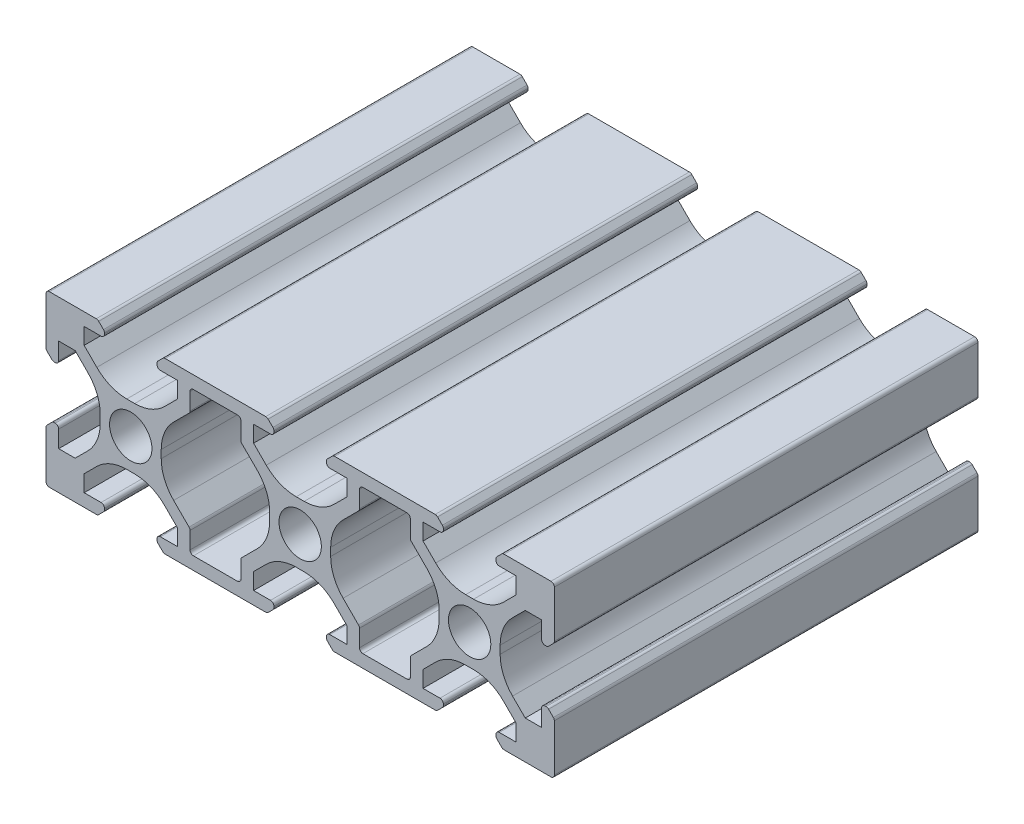
from build123d import *

# Parameters (mm, degrees)
RESSALTO_EXTRUS_O1_DEPTH    = 50
PADR_OCIRCULAR1_COUNT       = 4
PADR_O_LINEAR1_COUNT        = 3
PADR_O_LINEAR1_PITCH        = 20
PADR_O_LINEAR1_COPY_1_DEPTH = 50
PADR_O_LINEAR1_COPY_2_DEPTH = 50
PADR_O_LINEAR1_COPY_3_DEPTH = 50
PADR_O_LINEAR1_COPY_4_DEPTH = 50
PADR_O_LINEAR1_COPY_5_DEPTH = 50
PADR_O_LINEAR1_COPY_6_DEPTH = 50
CORTE_EXTRUS_O1_DEPTH       = 72.414284285
PADR_O_LINEAR2_COUNT        = 2
PADR_O_LINEAR2_PITCH        = 20
FILETE1_R                   = 0.4
FILETE2_R                   = 0.4


with BuildPart() as part:
    # Esboço1 → Ressalto-extrusão1 (new body)
    with BuildSketch(Plane.XY):
        with BuildLine():
            ThreePointArc((-9.317157288, 3.217157288), (-9.187387948, 3.130448187), (-9.034314575, 3.1))
            Line((-9.034314575, 3.1), (-8.9, 3.1))
            ThreePointArc((-8.9, 3.1), (-8.617157288, 3.217157288), (-8.5, 3.5))
            Line((-8.5, 3.5), (-8.5, 5.5))
            Line((-8.5, 5.5), (-6.560660172, 5.5))
            Line((-6.560660172, 5.5), (-5.064466094, 4.003805922))
            ThreePointArc((-5.064466094, 4.003805922), (-3.980602337, 2.381689178), (-3.6, 0.468272016))
            Line((-3.6, 0.468272016), (-3.6, 0))
            Line((-3.6, 0), (-2.5, 0))
            ThreePointArc((-2.5, 0), (-1.767766953, 1.767766953), (0, 2.5))
            Line((0, 2.5), (0, 3.6))
            Line((0, 3.6), (-0.468272016, 3.6))
            ThreePointArc((-0.468272016, 3.6), (-2.381689178, 3.980602337), (-4.003805922, 5.064466094))
            Line((-4.003805922, 5.064466094), (-5.5, 6.560660172))
            Line((-5.5, 6.560660172), (-5.5, 8.5))
            Line((-5.5, 8.5), (-3.5, 8.5))
            ThreePointArc((-3.5, 8.5), (-3.217157288, 8.617157288), (-3.1, 8.9))
            Line((-3.1, 8.9), (-3.1, 9.034314575))
            ThreePointArc((-3.1, 9.034314575), (-3.130448187, 9.187387948), (-3.217157288, 9.317157288))
            Line((-3.217157288, 9.317157288), (-3.782842712, 9.882842712))
            ThreePointArc((-3.782842712, 9.882842712), (-3.912612052, 9.969551813), (-4.065685425, 10))
            Line((-4.065685425, 10), (-10, 10))
            Line((-10, 10), (-10, 4.065685425))
            ThreePointArc((-10, 4.065685425), (-9.969551813, 3.912612052), (-9.882842712, 3.782842712))
            Line((-9.882842712, 3.782842712), (-9.317157288, 3.217157288))
        make_face()
    ressalto_extrus_o1 = extrude(amount=RESSALTO_EXTRUS_O1_DEPTH)

    # PadrãoCircular1: Ressalto-extrusão1 ×4 about axis
    padr_ocircular1_axis = Axis((0, 0, 0), (0, 0, 1))
    for i in range(1, PADR_OCIRCULAR1_COUNT):
        add(ressalto_extrus_o1.rotate(padr_ocircular1_axis, i * 360 / PADR_OCIRCULAR1_COUNT))

    # Padrão linear1: Ressalto-extrusão1 ×3
    with Locations(*[(i * PADR_O_LINEAR1_PITCH, 0, 0) for i in range(1, PADR_O_LINEAR1_COUNT)]):
        add(ressalto_extrus_o1)

    # Padrão linear1 copy 1 sketch → Padrão linear1 copy 1 (add)
    with BuildSketch(Plane(origin=(20, 0, 0), x_dir=(0, 1, 0), z_dir=(0, 0, 1))):
        with BuildLine():
            ThreePointArc((-9.317157288, 3.217157288), (-9.187387948, 3.130448187), (-9.034314575, 3.1))
            Line((-9.034314575, 3.1), (-8.9, 3.1))
            ThreePointArc((-8.9, 3.1), (-8.617157288, 3.217157288), (-8.5, 3.5))
            Line((-8.5, 3.5), (-8.5, 5.5))
            Line((-8.5, 5.5), (-6.560660172, 5.5))
            Line((-6.560660172, 5.5), (-5.064466094, 4.003805922))
            ThreePointArc((-5.064466094, 4.003805922), (-3.980602337, 2.381689178), (-3.6, 0.468272016))
            Line((-3.6, 0.468272016), (-3.6, 0))
            Line((-3.6, 0), (-2.5, 0))
            ThreePointArc((-2.5, 0), (-1.767766953, 1.767766953), (0, 2.5))
            Line((0, 2.5), (0, 3.6))
            Line((0, 3.6), (-0.468272016, 3.6))
            ThreePointArc((-0.468272016, 3.6), (-2.381689178, 3.980602337), (-4.003805922, 5.064466094))
            Line((-4.003805922, 5.064466094), (-5.5, 6.560660172))
            Line((-5.5, 6.560660172), (-5.5, 8.5))
            Line((-5.5, 8.5), (-3.5, 8.5))
            ThreePointArc((-3.5, 8.5), (-3.217157288, 8.617157288), (-3.1, 8.9))
            Line((-3.1, 8.9), (-3.1, 9.034314575))
            ThreePointArc((-3.1, 9.034314575), (-3.130448187, 9.187387948), (-3.217157288, 9.317157288))
            Line((-3.217157288, 9.317157288), (-3.782842712, 9.882842712))
            ThreePointArc((-3.782842712, 9.882842712), (-3.912612052, 9.969551813), (-4.065685425, 10))
            Line((-4.065685425, 10), (-10, 10))
            Line((-10, 10), (-10, 4.065685425))
            ThreePointArc((-10, 4.065685425), (-9.969551813, 3.912612052), (-9.882842712, 3.782842712))
            Line((-9.882842712, 3.782842712), (-9.317157288, 3.217157288))
        make_face()
    extrude(amount=PADR_O_LINEAR1_COPY_1_DEPTH)

    # Padrão linear1 copy 2 sketch → Padrão linear1 copy 2 (add)
    with BuildSketch(Plane(origin=(40, 0, 0), x_dir=(0, 1, 0), z_dir=(0, 0, 1))):
        with BuildLine():
            ThreePointArc((-9.317157288, 3.217157288), (-9.187387948, 3.130448187), (-9.034314575, 3.1))
            Line((-9.034314575, 3.1), (-8.9, 3.1))
            ThreePointArc((-8.9, 3.1), (-8.617157288, 3.217157288), (-8.5, 3.5))
            Line((-8.5, 3.5), (-8.5, 5.5))
            Line((-8.5, 5.5), (-6.560660172, 5.5))
            Line((-6.560660172, 5.5), (-5.064466094, 4.003805922))
            ThreePointArc((-5.064466094, 4.003805922), (-3.980602337, 2.381689178), (-3.6, 0.468272016))
            Line((-3.6, 0.468272016), (-3.6, 0))
            Line((-3.6, 0), (-2.5, 0))
            ThreePointArc((-2.5, 0), (-1.767766953, 1.767766953), (0, 2.5))
            Line((0, 2.5), (0, 3.6))
            Line((0, 3.6), (-0.468272016, 3.6))
            ThreePointArc((-0.468272016, 3.6), (-2.381689178, 3.980602337), (-4.003805922, 5.064466094))
            Line((-4.003805922, 5.064466094), (-5.5, 6.560660172))
            Line((-5.5, 6.560660172), (-5.5, 8.5))
            Line((-5.5, 8.5), (-3.5, 8.5))
            ThreePointArc((-3.5, 8.5), (-3.217157288, 8.617157288), (-3.1, 8.9))
            Line((-3.1, 8.9), (-3.1, 9.034314575))
            ThreePointArc((-3.1, 9.034314575), (-3.130448187, 9.187387948), (-3.217157288, 9.317157288))
            Line((-3.217157288, 9.317157288), (-3.782842712, 9.882842712))
            ThreePointArc((-3.782842712, 9.882842712), (-3.912612052, 9.969551813), (-4.065685425, 10))
            Line((-4.065685425, 10), (-10, 10))
            Line((-10, 10), (-10, 4.065685425))
            ThreePointArc((-10, 4.065685425), (-9.969551813, 3.912612052), (-9.882842712, 3.782842712))
            Line((-9.882842712, 3.782842712), (-9.317157288, 3.217157288))
        make_face()
    extrude(amount=PADR_O_LINEAR1_COPY_2_DEPTH)

    # Padrão linear1 copy 3 sketch → Padrão linear1 copy 3 (add)
    with BuildSketch(Plane(origin=(20, 0, 0), x_dir=(-1, 0, 0), z_dir=(0, 0, 1))):
        with BuildLine():
            ThreePointArc((-9.317157288, 3.217157288), (-9.187387948, 3.130448187), (-9.034314575, 3.1))
            Line((-9.034314575, 3.1), (-8.9, 3.1))
            ThreePointArc((-8.9, 3.1), (-8.617157288, 3.217157288), (-8.5, 3.5))
            Line((-8.5, 3.5), (-8.5, 5.5))
            Line((-8.5, 5.5), (-6.560660172, 5.5))
            Line((-6.560660172, 5.5), (-5.064466094, 4.003805922))
            ThreePointArc((-5.064466094, 4.003805922), (-3.980602337, 2.381689178), (-3.6, 0.468272016))
            Line((-3.6, 0.468272016), (-3.6, 0))
            Line((-3.6, 0), (-2.5, 0))
            ThreePointArc((-2.5, 0), (-1.767766953, 1.767766953), (0, 2.5))
            Line((0, 2.5), (0, 3.6))
            Line((0, 3.6), (-0.468272016, 3.6))
            ThreePointArc((-0.468272016, 3.6), (-2.381689178, 3.980602337), (-4.003805922, 5.064466094))
            Line((-4.003805922, 5.064466094), (-5.5, 6.560660172))
            Line((-5.5, 6.560660172), (-5.5, 8.5))
            Line((-5.5, 8.5), (-3.5, 8.5))
            ThreePointArc((-3.5, 8.5), (-3.217157288, 8.617157288), (-3.1, 8.9))
            Line((-3.1, 8.9), (-3.1, 9.034314575))
            ThreePointArc((-3.1, 9.034314575), (-3.130448187, 9.187387948), (-3.217157288, 9.317157288))
            Line((-3.217157288, 9.317157288), (-3.782842712, 9.882842712))
            ThreePointArc((-3.782842712, 9.882842712), (-3.912612052, 9.969551813), (-4.065685425, 10))
            Line((-4.065685425, 10), (-10, 10))
            Line((-10, 10), (-10, 4.065685425))
            ThreePointArc((-10, 4.065685425), (-9.969551813, 3.912612052), (-9.882842712, 3.782842712))
            Line((-9.882842712, 3.782842712), (-9.317157288, 3.217157288))
        make_face()
    extrude(amount=PADR_O_LINEAR1_COPY_3_DEPTH)

    # Padrão linear1 copy 4 sketch → Padrão linear1 copy 4 (add)
    with BuildSketch(Plane(origin=(40, 0, 0), x_dir=(-1, 0, 0), z_dir=(0, 0, 1))):
        with BuildLine():
            ThreePointArc((-9.317157288, 3.217157288), (-9.187387948, 3.130448187), (-9.034314575, 3.1))
            Line((-9.034314575, 3.1), (-8.9, 3.1))
            ThreePointArc((-8.9, 3.1), (-8.617157288, 3.217157288), (-8.5, 3.5))
            Line((-8.5, 3.5), (-8.5, 5.5))
            Line((-8.5, 5.5), (-6.560660172, 5.5))
            Line((-6.560660172, 5.5), (-5.064466094, 4.003805922))
            ThreePointArc((-5.064466094, 4.003805922), (-3.980602337, 2.381689178), (-3.6, 0.468272016))
            Line((-3.6, 0.468272016), (-3.6, 0))
            Line((-3.6, 0), (-2.5, 0))
            ThreePointArc((-2.5, 0), (-1.767766953, 1.767766953), (0, 2.5))
            Line((0, 2.5), (0, 3.6))
            Line((0, 3.6), (-0.468272016, 3.6))
            ThreePointArc((-0.468272016, 3.6), (-2.381689178, 3.980602337), (-4.003805922, 5.064466094))
            Line((-4.003805922, 5.064466094), (-5.5, 6.560660172))
            Line((-5.5, 6.560660172), (-5.5, 8.5))
            Line((-5.5, 8.5), (-3.5, 8.5))
            ThreePointArc((-3.5, 8.5), (-3.217157288, 8.617157288), (-3.1, 8.9))
            Line((-3.1, 8.9), (-3.1, 9.034314575))
            ThreePointArc((-3.1, 9.034314575), (-3.130448187, 9.187387948), (-3.217157288, 9.317157288))
            Line((-3.217157288, 9.317157288), (-3.782842712, 9.882842712))
            ThreePointArc((-3.782842712, 9.882842712), (-3.912612052, 9.969551813), (-4.065685425, 10))
            Line((-4.065685425, 10), (-10, 10))
            Line((-10, 10), (-10, 4.065685425))
            ThreePointArc((-10, 4.065685425), (-9.969551813, 3.912612052), (-9.882842712, 3.782842712))
            Line((-9.882842712, 3.782842712), (-9.317157288, 3.217157288))
        make_face()
    extrude(amount=PADR_O_LINEAR1_COPY_4_DEPTH)

    # Padrão linear1 copy 5 sketch → Padrão linear1 copy 5 (add)
    with BuildSketch(Plane(origin=(20, 0, 0), x_dir=(0, -1, 0), z_dir=(0, 0, 1))):
        with BuildLine():
            ThreePointArc((-9.317157288, 3.217157288), (-9.187387948, 3.130448187), (-9.034314575, 3.1))
            Line((-9.034314575, 3.1), (-8.9, 3.1))
            ThreePointArc((-8.9, 3.1), (-8.617157288, 3.217157288), (-8.5, 3.5))
            Line((-8.5, 3.5), (-8.5, 5.5))
            Line((-8.5, 5.5), (-6.560660172, 5.5))
            Line((-6.560660172, 5.5), (-5.064466094, 4.003805922))
            ThreePointArc((-5.064466094, 4.003805922), (-3.980602337, 2.381689178), (-3.6, 0.468272016))
            Line((-3.6, 0.468272016), (-3.6, 0))
            Line((-3.6, 0), (-2.5, 0))
            ThreePointArc((-2.5, 0), (-1.767766953, 1.767766953), (0, 2.5))
            Line((0, 2.5), (0, 3.6))
            Line((0, 3.6), (-0.468272016, 3.6))
            ThreePointArc((-0.468272016, 3.6), (-2.381689178, 3.980602337), (-4.003805922, 5.064466094))
            Line((-4.003805922, 5.064466094), (-5.5, 6.560660172))
            Line((-5.5, 6.560660172), (-5.5, 8.5))
            Line((-5.5, 8.5), (-3.5, 8.5))
            ThreePointArc((-3.5, 8.5), (-3.217157288, 8.617157288), (-3.1, 8.9))
            Line((-3.1, 8.9), (-3.1, 9.034314575))
            ThreePointArc((-3.1, 9.034314575), (-3.130448187, 9.187387948), (-3.217157288, 9.317157288))
            Line((-3.217157288, 9.317157288), (-3.782842712, 9.882842712))
            ThreePointArc((-3.782842712, 9.882842712), (-3.912612052, 9.969551813), (-4.065685425, 10))
            Line((-4.065685425, 10), (-10, 10))
            Line((-10, 10), (-10, 4.065685425))
            ThreePointArc((-10, 4.065685425), (-9.969551813, 3.912612052), (-9.882842712, 3.782842712))
            Line((-9.882842712, 3.782842712), (-9.317157288, 3.217157288))
        make_face()
    extrude(amount=PADR_O_LINEAR1_COPY_5_DEPTH)

    # Padrão linear1 copy 6 sketch → Padrão linear1 copy 6 (add)
    with BuildSketch(Plane(origin=(40, 0, 0), x_dir=(0, -1, 0), z_dir=(0, 0, 1))):
        with BuildLine():
            ThreePointArc((-9.317157288, 3.217157288), (-9.187387948, 3.130448187), (-9.034314575, 3.1))
            Line((-9.034314575, 3.1), (-8.9, 3.1))
            ThreePointArc((-8.9, 3.1), (-8.617157288, 3.217157288), (-8.5, 3.5))
            Line((-8.5, 3.5), (-8.5, 5.5))
            Line((-8.5, 5.5), (-6.560660172, 5.5))
            Line((-6.560660172, 5.5), (-5.064466094, 4.003805922))
            ThreePointArc((-5.064466094, 4.003805922), (-3.980602337, 2.381689178), (-3.6, 0.468272016))
            Line((-3.6, 0.468272016), (-3.6, 0))
            Line((-3.6, 0), (-2.5, 0))
            ThreePointArc((-2.5, 0), (-1.767766953, 1.767766953), (0, 2.5))
            Line((0, 2.5), (0, 3.6))
            Line((0, 3.6), (-0.468272016, 3.6))
            ThreePointArc((-0.468272016, 3.6), (-2.381689178, 3.980602337), (-4.003805922, 5.064466094))
            Line((-4.003805922, 5.064466094), (-5.5, 6.560660172))
            Line((-5.5, 6.560660172), (-5.5, 8.5))
            Line((-5.5, 8.5), (-3.5, 8.5))
            ThreePointArc((-3.5, 8.5), (-3.217157288, 8.617157288), (-3.1, 8.9))
            Line((-3.1, 8.9), (-3.1, 9.034314575))
            ThreePointArc((-3.1, 9.034314575), (-3.130448187, 9.187387948), (-3.217157288, 9.317157288))
            Line((-3.217157288, 9.317157288), (-3.782842712, 9.882842712))
            ThreePointArc((-3.782842712, 9.882842712), (-3.912612052, 9.969551813), (-4.065685425, 10))
            Line((-4.065685425, 10), (-10, 10))
            Line((-10, 10), (-10, 4.065685425))
            ThreePointArc((-10, 4.065685425), (-9.969551813, 3.912612052), (-9.882842712, 3.782842712))
            Line((-9.882842712, 3.782842712), (-9.317157288, 3.217157288))
        make_face()
    extrude(amount=PADR_O_LINEAR1_COPY_6_DEPTH)

    # Esboço4 → Corte-extrusão1 (cut, through all)
    with BuildSketch(Plane(origin=(0, 0, 0), x_dir=(-1, 0, 0), z_dir=(0, 0, -1))):
        Polygon((-13.439339828, 5.5), (-13, 5.939339828), (-13, 8.5), (-7, 8.5), (-7, 5.939339828), (-6.560660172, 5.5), (-6.560660172, -5.5), (-7, -5.939339828), (-7, -8.5), (-13, -8.5), (-13, -5.939339828), (-13.439339828, -5.5), align=None)
    corte_extrus_o1 = extrude(amount=-CORTE_EXTRUS_O1_DEPTH, mode=Mode.SUBTRACT)

    # Padrão linear2: Corte-extrusão1 ×2
    with Locations(*[(i * PADR_O_LINEAR2_PITCH, 0, 0) for i in range(1, PADR_O_LINEAR2_COUNT)]):
        add(corte_extrus_o1, mode=Mode.SUBTRACT)

    # Filete1
    filete1_edges = [part.edges().sort_by_distance(p)[0] for p in [
        (13, 5.939339828, 25),
        (13, 8.5, 25),
        (7, 8.5, 25),
        (7, 5.939339828, 25),
        (7, -5.939339828, 25),
        (7, -8.5, 25),
        (13, -8.5, 25),
        (13, -5.939339828, 25),
        (33, 5.939339828, 25),
        (33, 8.5, 25),
        (27, 8.5, 25),
        (27, 5.939339828, 25),
        (27, -5.939339828, 25),
        (27, -8.5, 25),
        (33, -8.5, 25),
        (33, -5.939339828, 25),
    ]]
    fillet(filete1_edges, radius=FILETE1_R)

    # Filete2
    filete2_edges = [part.edges().sort_by_distance(p)[0] for p in [
        (-10, 10, 25),
        (50, -10, 25),
        (50, 10, 25),
        (-10, -10, 25),
    ]]
    fillet(filete2_edges, radius=FILETE2_R)


solid = part.part
